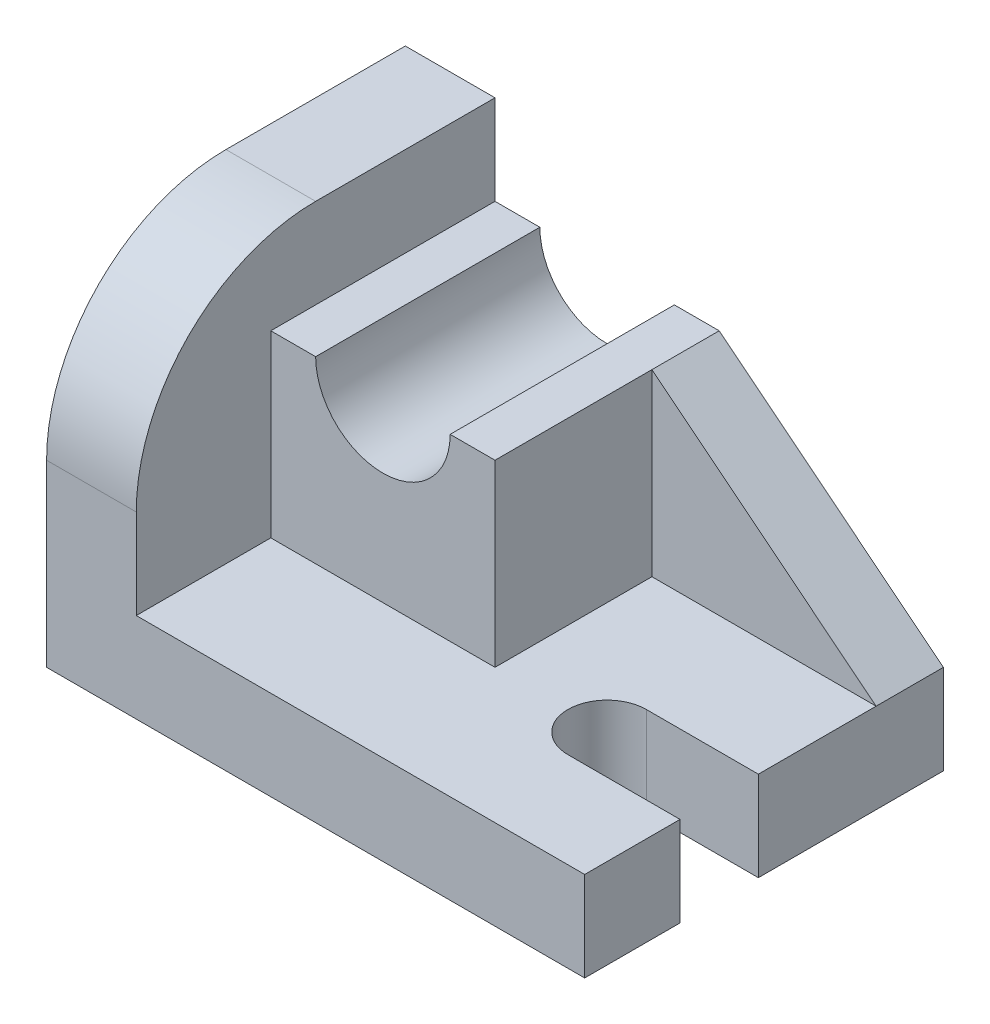
from build123d import *

# Parameters (mm, degrees)
BOSS_EXTRUDE1_DEPTH     = 64
BOSS_EXTRUDE2_DEPTH     = 40
BOSS_EXTRUDE3_DEPTH     = 12
FILLET2_R               = 32
CUT_EXTRUDE1_DEPTH      = 125.963994815
CUT_EXTRUDE1_DEPTH_BACK = 125.963994815


with BuildPart() as part:
    # Sketch1 → Boss-Extrude1 (new body)
    with BuildSketch(Plane.XY):
        Polygon((16, 48), (16, 64), (0, 64), (0, 0), (96, 0), (96, 16), (56, 16), (16, 16), align=None)
    extrude(amount=BOSS_EXTRUDE1_DEPTH)

    # Sketch1<3> → Boss-Extrude2 (add)
    with BuildSketch(Plane.XY):
        with BuildLine():
            Line((24, 48), (16, 48))
            Line((16, 48), (16, 16))
            Line((16, 16), (56, 16))
            Line((56, 16), (56, 48))
            Line((56, 48), (48, 48))
            ThreePointArc((48, 48), (36, 36), (24, 48))
        make_face()
    extrude(amount=BOSS_EXTRUDE2_DEPTH)

    # Sketch1<4> → Boss-Extrude3 (add)
    with BuildSketch(Plane.XY):
        Polygon((56, 48), (56, 16), (96, 16), align=None)
    extrude(amount=BOSS_EXTRUDE3_DEPTH)

    # Fillet2
    fillet2_edges = [part.edges().sort_by_distance(p)[0] for p in [
        (8, 64, 64),
    ]]
    fillet(fillet2_edges, radius=FILLET2_R)

    # Sketch2 → Cut-Extrude1 (cut, two sides: drawn at the far end of the back side and taken through both)
    with BuildSketch(Plane(origin=(0, 16, 0), x_dir=(1, 0, 0), z_dir=(0, 1, 0)).offset(-CUT_EXTRUDE1_DEPTH_BACK)):
        with BuildLine():
            Line((319.765927442, -46.98901929), (96, -46.98901929))
            Line((96, -46.98901929), (76, -46.98901929))
            ThreePointArc((76, -46.98901929), (69.01098071, -40), (76, -33.01098071))
            Line((76, -33.01098071), (96, -33.01098071))
            Line((96, -33.01098071), (319.765927442, -33.01098071))
            Line((319.765927442, -33.01098071), (767.297782327, -33.01098071))
            Line((767.297782327, -33.01098071), (767.297782327, -46.98901929))
            Line((767.297782327, -46.98901929), (319.765927442, -46.98901929))
        make_face()
    extrude(amount=CUT_EXTRUDE1_DEPTH + CUT_EXTRUDE1_DEPTH_BACK, mode=Mode.SUBTRACT)


solid = part.part
